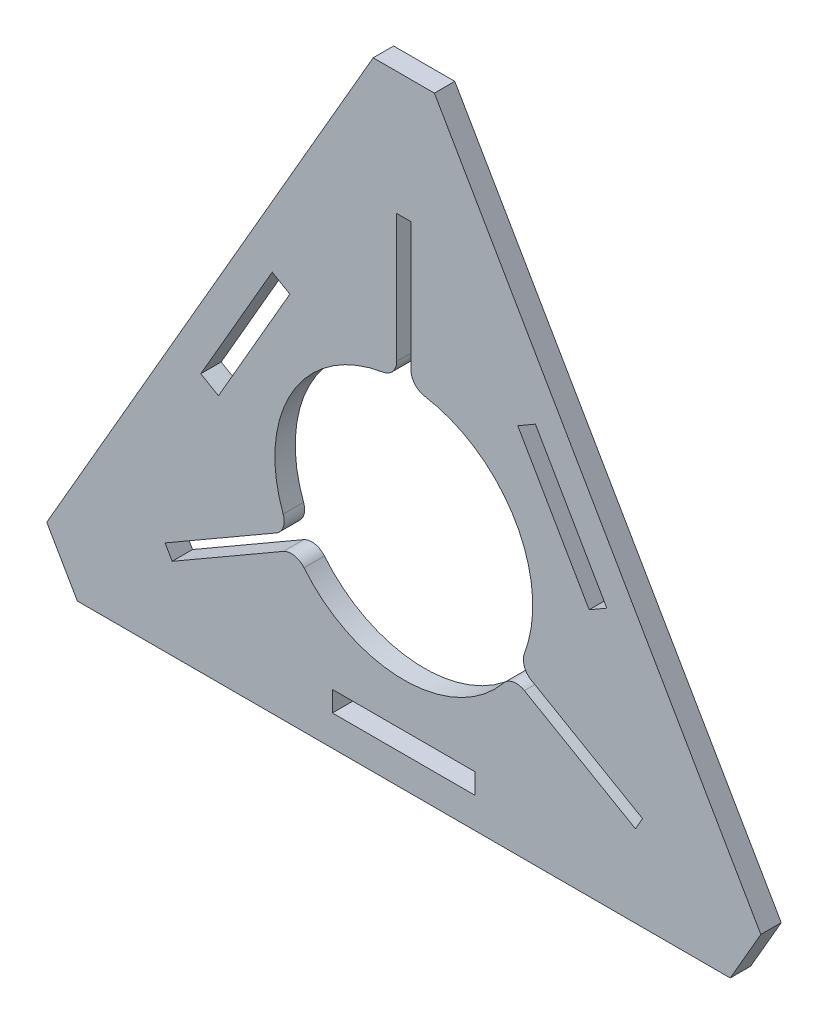
from build123d import *

# Parameters (mm, degrees)
SKETCH1_W           = 44.45
SKETCH1_H           = 6.35
BOSS_EXTRUDE1_DEPTH = 6.35


with BuildPart() as part:
    # Sketch1 → Boss-Extrude1 (new body)
    with BuildSketch(Plane.XY):
        Polygon((0, -69.657309978), (101.6, -69.657309978), (111.125, -53.159526036), (9.525, 122.816836013), (-9.525, 122.816836013), (-111.125, -53.159526036), (-101.6, -69.657309978), align=None)
        with BuildLine():
            Line((-2.2225, 84.520411999), (2.2225, 84.520411999))
            Line((2.2225, 84.520411999), (2.2225, 44.618364355))
            ThreePointArc((2.2225, 44.618364355), (3.431158596, 41.32912193), (6.481994382, 39.60506499))
            ThreePointArc((6.481994382, 39.60506499), (34.755331505, 20.066), (37.539989591, -14.188960693))
            ThreePointArc((37.539989591, -14.188960693), (37.507648806, -17.693090457), (39.751887007, -20.384440718))
            Line((39.751887007, -20.384440718), (74.308073929, -40.335464539))
            Line((74.308073929, -40.335464539), (72.085573929, -44.184947459))
            Line((72.085573929, -44.184947459), (37.529387007, -24.233923638))
            ThreePointArc((37.529387007, -24.233923638), (34.07649021, -23.636031473), (31.057995209, -25.416104297))
            ThreePointArc((31.057995209, -25.416104297), (0, -40.132), (-31.057995209, -25.416104297))
            ThreePointArc((-31.057995209, -25.416104297), (-34.07649021, -23.636031473), (-37.529387007, -24.233923638))
            Line((-37.529387007, -24.233923638), (-72.085573929, -44.184947459))
            Line((-72.085573929, -44.184947459), (-74.308073929, -40.335464539))
            Line((-74.308073929, -40.335464539), (-39.751887007, -20.384440718))
            ThreePointArc((-39.751887007, -20.384440718), (-37.507648806, -17.693090457), (-37.539989591, -14.188960693))
            ThreePointArc((-37.539989591, -14.188960693), (-34.755331505, 20.066), (-6.481994382, 39.60506499))
            ThreePointArc((-6.481994382, 39.60506499), (-3.431158596, 41.32912193), (-2.2225, 44.618364355))
            Line((-2.2225, 44.618364355), (-2.2225, 84.520411999))
        make_face(mode=Mode.SUBTRACT)
        with Locations((0, -56.957309978)):
            Rectangle(SKETCH1_W, SKETCH1_H, mode=Mode.SUBTRACT)
        Polygon((-63.188608029, 10.81874039), (-40.963608029, 49.313569588), (-35.464346715, 46.138569588), (-57.689346715, 7.64374039), align=None, mode=Mode.SUBTRACT)
        Polygon((40.963608029, 49.313569588), (35.464346715, 46.138569588), (57.689346715, 7.64374039), (63.188608029, 10.81874039), align=None, mode=Mode.SUBTRACT)
    extrude(amount=BOSS_EXTRUDE1_DEPTH)


solid = part.part
